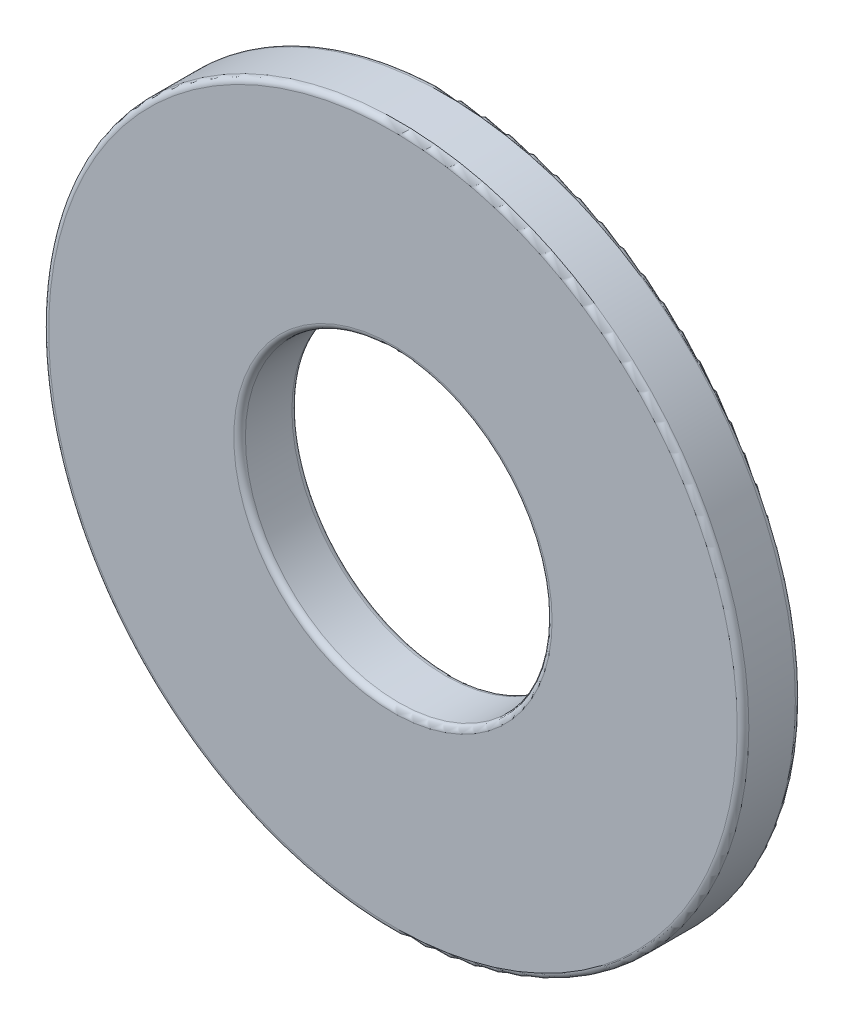
from build123d import *

# Parameters (mm, degrees)
BOSS_EXTRUDE1_DEPTH      = 1.0541
BOSS_EXTRUDE1_DEPTH_BACK = 1.0541
SKETCH3_R                = 12.7
SKETCH3_R_2              = 5.5626
FILLET1_R                = 0.21082


with BuildPart() as part:
    # Sketch3 → Boss-Extrude1 (new, two sides: drawn at the far end of the back side and taken through both)
    with BuildSketch(Plane.XY.offset(-BOSS_EXTRUDE1_DEPTH_BACK)):
        Circle(SKETCH3_R)
        Circle(SKETCH3_R_2, mode=Mode.SUBTRACT)
    extrude(amount=BOSS_EXTRUDE1_DEPTH + BOSS_EXTRUDE1_DEPTH_BACK)

    # Fillet1
    fillet1_edges = [part.edges().sort_by_distance(p)[0] for p in [
        (-12.7, 0, -1.0541),
        (-5.5626, 0, -1.0541),
        (-12.7, 0, 1.0541),
        (-5.5626, 0, 1.0541),
    ]]
    fillet(fillet1_edges, radius=FILLET1_R)


solid = part.part
